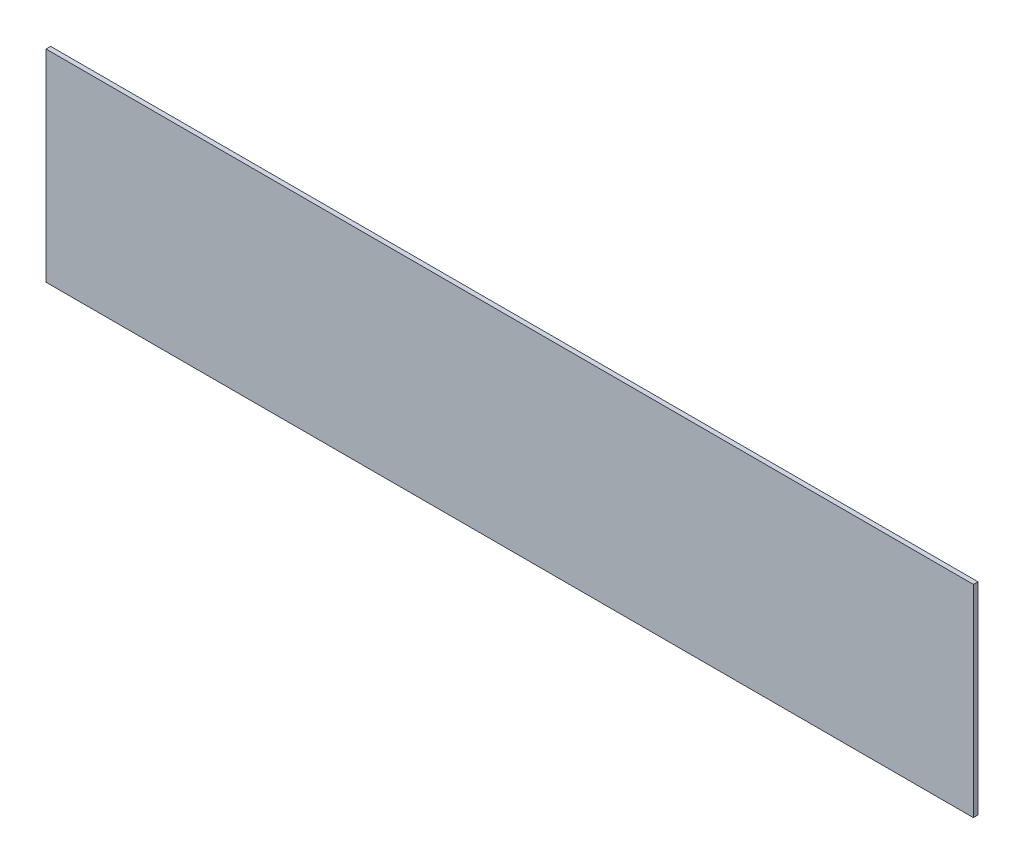
from build123d import *

# Parameters (mm, degrees)
SKETCH1_W           = 2020
SKETCH1_H           = 440
BOSS_EXTRUDE1_DEPTH = 10


with BuildPart() as part:
    # Sketch1 → Boss-Extrude1 (new body)
    with BuildSketch(Plane.XY):
        Rectangle(SKETCH1_W, SKETCH1_H)
    extrude(amount=BOSS_EXTRUDE1_DEPTH)


solid = part.part
